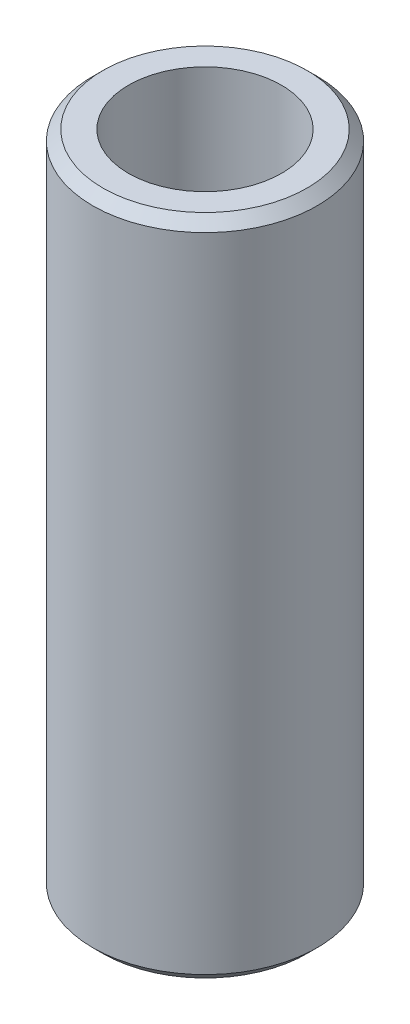
from build123d import *

# Parameters (mm, degrees)
SKETCH1_R           = 22
SKETCH1_R_2         = 15
BOSS_EXTRUDE1_DEPTH = 130
CHAMFER1_SIZE       = 2


with BuildPart() as part:
    # Sketch1 → Boss-Extrude1 (new body)
    with BuildSketch(Plane(origin=(0, 0, 0), x_dir=(1, 0, 0), z_dir=(0, 1, 0))):
        with Locations(Location((0, 0, 0), (0, 0, 270))):
            Circle(SKETCH1_R)
        with Locations(Location((0, 0, 0), (0, 0, 270))):
            Circle(SKETCH1_R_2, mode=Mode.SUBTRACT)
    extrude(amount=-BOSS_EXTRUDE1_DEPTH)

    # Chamfer1
    chamfer1_edges = [part.edges().sort_by_distance(p)[0] for p in [
        (0, 0, -22),
        (0, -130, -22),
    ]]
    chamfer(chamfer1_edges, length=CHAMFER1_SIZE)


solid = part.part
